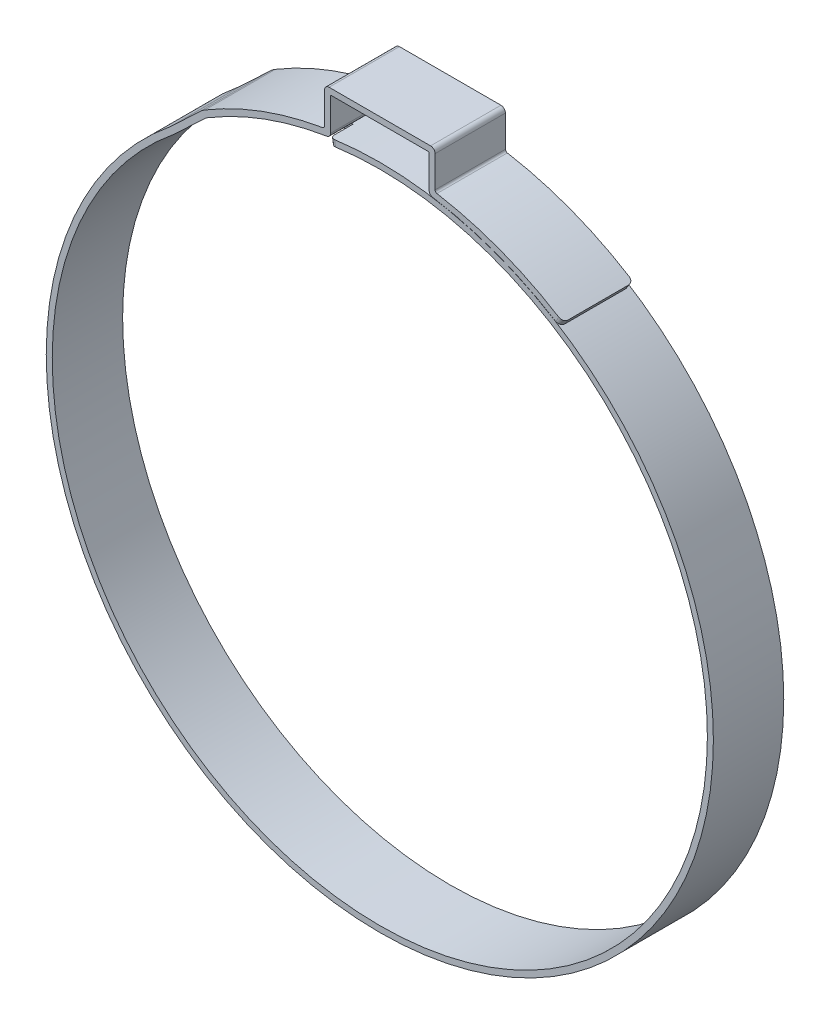
from build123d import *

# Parameters (mm, degrees)
BOSS_EXTRUDE1_DEPTH = 3.571875
SHELL1_T            = -0.6096
EXTRUDE_THIN3_DEPTH = 3.571875
EXTRUDE_THIN4_DEPTH = 3.571875
EXTRUDE_THIN6_DEPTH = 1.190625
FILLET4_R           = 0.4572
FILLET5_R           = 0.2286
FILLET6_R           = 0.1143
FILLET7_R           = 0.508


with BuildPart() as part:
    # Sketch1 → Boss-Extrude1 (new, symmetric)
    with BuildSketch(Plane.XY):
        Polygon((-5.6096, 33.514075028), (-5.6096, 37.873675028), (5.6096, 37.873675028), (5.6096, 33.514075028), (5, 33.514075028), (-5, 33.514075028), align=None)
    extrude(amount=BOSS_EXTRUDE1_DEPTH, both=True)

    # Shell1
    shell1_openings = [part.faces().sort_by_distance(p)[0] for p in [
        (0, 35.693875028, 3.571875),
        (0, 33.514075028, 0),
        (0, 35.693875028, -3.571875),
    ]]
    offset(amount=SHELL1_T, openings=shell1_openings, kind=Kind.INTERSECTION)

    # Sketch5 → Extrude-Thin3 (add, symmetric)
    with BuildSketch(Plane.XY):
        with BuildLine():
            ThreePointArc((5, 33.514075028), (11.90262143, 31.725712413), (18.278169619, 28.532468179))
            Line((18.278169619, 28.532468179), (18.606998664, 29.045774734))
            ThreePointArc((18.606998664, 29.045774734), (12.116752698, 32.296466265), (5.089951306, 34.117001991))
            Line((5.089951306, 34.117001991), (5, 33.514075028))
        make_face()
    extrude(amount=EXTRUDE_THIN3_DEPTH, both=True)

    # Sketch6 → Extrude-Thin4 (add, symmetric)
    with BuildSketch(Plane.XY):
        with BuildLine():
            ThreePointArc((-5, 33.514075028), (-11.439087927, 31.895775463), (-17.43901324, 29.052952384))
            ThreePointArc((-17.43901324, 29.052952384), (-17.647474534, 28.911954573), (-17.839493718, 28.749273517))
            Line((-17.839493718, 28.749273517), (-20.819129436, 25.934444001))
            ThreePointArc((-20.819129436, 25.934444001), (-20.883929256, 25.875496119), (-20.950901421, 25.819028441))
            ThreePointArc((-20.950901421, 25.819028441), (-24.112077535, 22.894763964), (-26.868805255, 19.586469927))
            ThreePointArc((-26.868805255, 19.586469927), (17.263572049, -28.417100135), (-5, 32.871910501))
            Line((-5, 32.871910501), (-5.091669173, 33.474578671))
            ThreePointArc((-5.091669173, 33.474578671), (17.580079524, -28.938094548), (-27.361413486, 19.945565026))
            ThreePointArc((-27.361413486, 19.945565026), (-24.554144376, 23.314512779), (-21.335011782, 26.292390238))
            ThreePointArc((-21.335011782, 26.292390238), (-21.285580426, 26.334068357), (-21.237752451, 26.377577087))
            Line((-21.237752451, 26.377577087), (-18.258116733, 29.192406602))
            ThreePointArc((-18.258116733, 29.192406602), (-18.015805435, 29.397695767), (-17.752745643, 29.575622585))
            ThreePointArc((-17.752745643, 29.575622585), (-11.644880107, 32.469588794), (-5.089951306, 34.117001991))
            Line((-5.089951306, 34.117001991), (-5, 33.514075028))
        make_face()
    extrude(amount=EXTRUDE_THIN4_DEPTH, both=True)

    # Sketch9 → Extrude-Thin6 (add, symmetric)
    with BuildSketch(Plane.XY):
        with BuildLine():
            ThreePointArc((-5, 32.871910501), (-11.269306607, 31.282027246), (-17.112208653, 28.508504258))
            Line((-17.112208653, 28.508504258), (-17.425941056, 29.031174459))
            ThreePointArc((-17.425941056, 29.031174459), (-11.47591621, 31.855546759), (-5.091669173, 33.474578671))
            Line((-5.091669173, 33.474578671), (-5, 32.871910501))
        make_face()
    extrude(amount=EXTRUDE_THIN6_DEPTH, both=True)

    # Fillet4
    fillet4_edges = [part.edges().sort_by_distance(p)[0] for p in [
        (-5.6096, 37.873675028, 0),
        (5.6096, 37.873675028, 0),
        (5, 33.514075028, 0),
        (-5, 33.514075028, 0),
    ]]
    fillet(fillet4_edges, radius=FILLET4_R)

    # Fillet5
    fillet5_edges = [part.edges().sort_by_distance(p)[0] for p in [
        (5.6096, 34.035420036, 0),
        (-5.6096, 34.035420036, 0),
    ]]
    fillet(fillet5_edges, radius=FILLET5_R)

    # Fillet6
    fillet6_edges = [part.edges().sort_by_distance(p)[0] for p in [
        (5, 37.264075028, 0),
        (-5, 37.264075028, 0),
    ]]
    fillet(fillet6_edges, radius=FILLET6_R)

    # Fillet7
    fillet7_edges = [part.edges().sort_by_distance(p)[0] for p in [
        (18.442584141, 28.789121456, -3.571875),
        (18.442584141, 28.789121456, 3.571875),
        (-5.045834586, 33.173244586, -3.571875),
        (-5.045834586, 33.173244586, 3.571875),
        (-17.269074855, 28.769839358, 1.190625),
        (-17.269074855, 28.769839358, -1.190625),
    ]]
    fillet(fillet7_edges, radius=FILLET7_R)


solid = part.part
